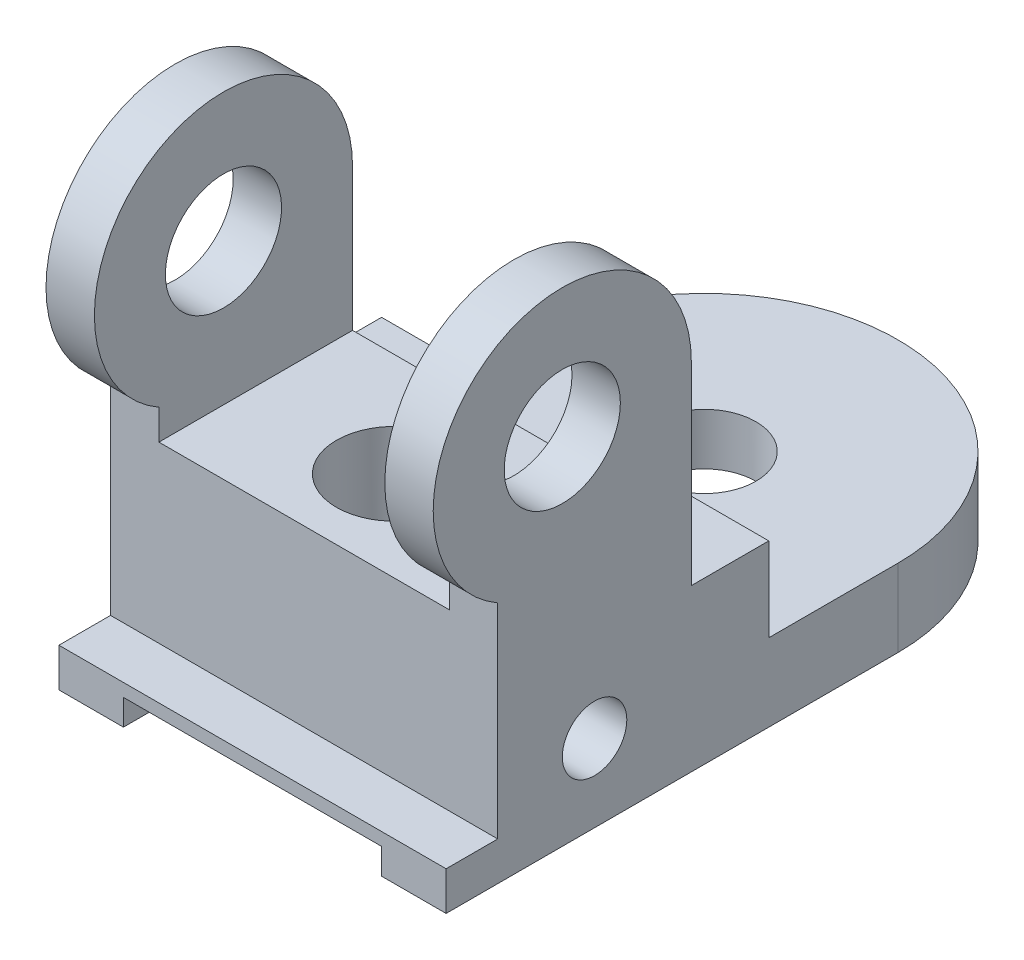
from build123d import *

# Parameters (mm, degrees)
ESQUISSE2_R             = 9
ESQUISSE2_R_2           = 5
BOSS_EXTRU_1_DEPTH      = 60
ESQUISSE3_W             = 40
ESQUISSE3_H             = 4
ESQUISSE3_W_2           = 45
ESQUISSE3_H_2           = 42
ENL_V_MAT_EXTRU_1_DEPTH = 85
CONG_1_RADIUS           = 30
CONG_1_LENGTH           = 12
ESQUISSE4_R             = 9
ESQUISSE4_R_2           = 8.001463265
ENL_V_MAT_EXTRU_2_DEPTH = 85
ESQUISSE5_R             = 13
ENL_V_MAT_EXTRU_3_DEPTH = 12


with BuildPart() as part:
    # Esquisse2 → Boss.-Extru.1 (new body)
    with BuildSketch(Plane(origin=(0, 0, 0), x_dir=(0, 0, -1), z_dir=(1, 0, 0))):
        with BuildLine():
            Line((0, -25.5), (-50, -25.5))
            Line((-50, -25.5), (-50, -12.5))
            Line((-50, -12.5), (-62, -12.5))
            Line((-62, -12.5), (-62, 17.5))
            ThreePointArc((-62, 17.5), (-92, 34.820508076), (-92, 0.179491924))
            Line((-92, 0.179491924), (-92, -31.5))
            Line((-92, -31.5), (-100, -31.5))
            Line((-100, -31.5), (-100, -37.5))
            Line((-100, -37.5), (0, -37.5))
            Line((0, -37.5), (0, -25.5))
        make_face()
        with Locations((-82, 17.5)):
            Circle(ESQUISSE2_R, mode=Mode.SUBTRACT)
        with Locations((-77, -25.5)):
            Circle(ESQUISSE2_R_2, mode=Mode.SUBTRACT)
    extrude(amount=BOSS_EXTRU_1_DEPTH)

    # Esquisse3 → Enlèv. mat.-Extru.1 (cut, symmetric)
    with BuildSketch(Plane(origin=(0, 0, 62), x_dir=(-1, 0, 0), z_dir=(0, 0, -1))):
        with Locations((-30, -35.5)):
            Rectangle(ESQUISSE3_W, ESQUISSE3_H)
        with Locations((-30, 16.5)):
            Rectangle(ESQUISSE3_W_2, ESQUISSE3_H_2)
    extrude(amount=ENL_V_MAT_EXTRU_1_DEPTH, both=True, mode=Mode.SUBTRACT)

    # Congé1: full round fillet: the end face becomes a half cylinder, R = half its width
    cong_1_face = Plane((30, -31.5, 0), x_dir=(0, -1, 0), z_dir=(0, 0, -1))  # on the end face: x along it, z out of the body
    cong_1_slab = cong_1_face.offset(-CONG_1_RADIUS / 2) * Box(CONG_1_LENGTH, 2 * CONG_1_RADIUS, CONG_1_RADIUS, mode=Mode.PRIVATE)  # the body's end, R deep
    cong_1_round = Plane((30, -31.5, 30), x_dir=(0, 0, -1), z_dir=(0, -1, 0)) * Cylinder(CONG_1_RADIUS, CONG_1_LENGTH, mode=Mode.PRIVATE)  # its axis R under the face
    add(cong_1_slab - cong_1_round, mode=Mode.SUBTRACT)

    # Esquisse4 → Enlèv. mat.-Extru.2 (cut, symmetric)
    with BuildSketch(Plane(origin=(0, -4.5, 0), x_dir=(1, 0, 0), z_dir=(0, 1, 0))):
        with Locations(Location((30, -78, 0), (0, 0, 270))):
            Circle(ESQUISSE4_R)
        with Locations(Location((30, -30, 0), (0, 0, 270))):
            Circle(ESQUISSE4_R_2)
    extrude(amount=ENL_V_MAT_EXTRU_2_DEPTH, both=True, mode=Mode.SUBTRACT)

    # Esquisse5 → Enlèv. mat.-Extru.3 (cut)
    with BuildSketch(Plane(origin=(0, 0, 50), x_dir=(-1, 0, 0), z_dir=(0, 0, -1))):
        with Locations((-30, -12.5)):
            Circle(ESQUISSE5_R)
    extrude(amount=-ENL_V_MAT_EXTRU_3_DEPTH, mode=Mode.SUBTRACT)


solid = part.part
